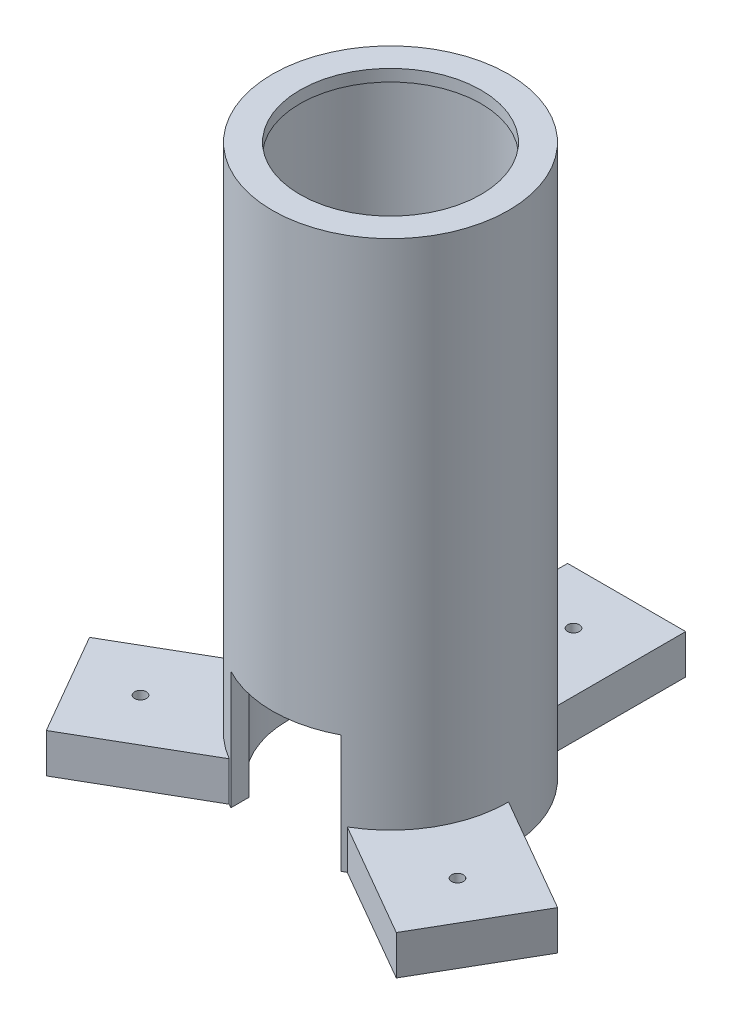
from build123d import *

# Parameters (mm, degrees)
SKETCH1_R           = 15
SKETCH1_R_2         = 13
BOSS_EXTRUDE1_DEPTH = 68.58
SKETCH2_R           = 15
SKETCH2_R_2         = 11.5
BOSS_EXTRUDE2_DEPTH = 1.5
SKETCH3_W           = 14
SKETCH3_H           = 15.591369762
CUT_EXTRUDE1_DEPTH  = 15
SKETCH4_R           = 0.75
BOSS_EXTRUDE3_DEPTH = 5
CIRPATTERN1_COUNT   = 3


with BuildPart() as part:
    # Sketch1 → Boss-Extrude1 (new body)
    with BuildSketch(Plane(origin=(0, 0, 0), x_dir=(1, 0, 0), z_dir=(0, 1, 0))):
        with Locations(Location((0, 0, 0), (0, 0, 270))):
            Circle(SKETCH1_R)
        with Locations(Location((0, 0, 0), (0, 0, 270))):
            Circle(SKETCH1_R_2, mode=Mode.SUBTRACT)
    extrude(amount=BOSS_EXTRUDE1_DEPTH)

    # Sketch2 → Boss-Extrude2 (add)
    with BuildSketch(Plane(origin=(0, 68.58, 0), x_dir=(1, 0, 0), z_dir=(0, 1, 0))):
        with Locations(Location((0, 0, 0), (0, 0, 270))):
            Circle(SKETCH2_R)
        with Locations(Location((0, 0, 0), (0, 0, 270))):
            Circle(SKETCH2_R_2, mode=Mode.SUBTRACT)
    extrude(amount=BOSS_EXTRUDE2_DEPTH)

    # Sketch3 → Cut-Extrude1 (cut)
    with BuildSketch(Plane.XZ):
        with Locations((0, 7.795684881)):
            Rectangle(SKETCH3_W, SKETCH3_H)
    extrude(amount=-CUT_EXTRUDE1_DEPTH, mode=Mode.SUBTRACT)

    # Sketch4 → Boss-Extrude3 (add)
    with BuildSketch(Plane.XZ):
        with BuildLine():
            Line((-7.5, -12.990381057), (-7.5, -30))
            Line((-7.5, -30), (7.5, -30))
            Line((7.5, -30), (7.5, -12.990381057))
            ThreePointArc((7.5, -12.990381057), (0, -15), (-7.5, -12.990381057))
        make_face()
        with Locations(Location((0, -23.25, 0), (0, 0, 270))):
            Circle(SKETCH4_R, mode=Mode.SUBTRACT)
    boss_extrude3 = extrude(amount=-BOSS_EXTRUDE3_DEPTH)

    # CirPattern1: Boss-Extrude3 ×3 about axis
    cirpattern1_axis = Axis((0, 0, 0), (0, 1, 0))
    for i in range(1, CIRPATTERN1_COUNT):
        add(boss_extrude3.rotate(cirpattern1_axis, i * 360 / CIRPATTERN1_COUNT))


solid = part.part
